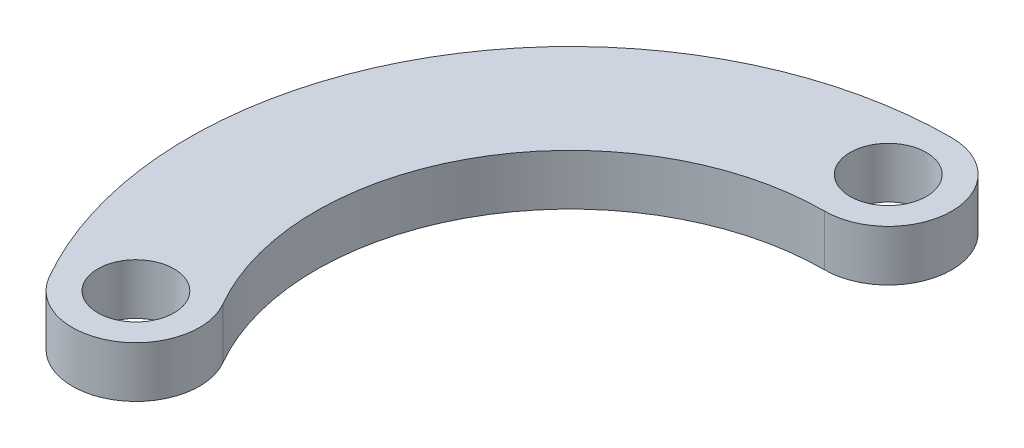
from build123d import *

# Parameters (mm, degrees)
SKETCH2_R           = 15
SKETCH2_R_2         = 10
SKETCH2_R_3         = 1.5
BOSS_EXTRUDE3_DEPTH = 2
CUT_EXTRUDE1_DEPTH  = 2
BOSS_EXTRUDE4_START = -2
SKETCH5_R           = 2.5
SKETCH5_R_2         = 1.5
BOSS_EXTRUDE4_DEPTH = 2


with BuildPart() as part:
    # Sketch2 → Boss-Extrude3 (new body)
    with BuildSketch(Plane(origin=(0, 0, 0), x_dir=(1, 0, 0), z_dir=(0, 1, 0))):
        with Locations(Location((0, 0, 0), (0, 0, 270))):
            Circle(SKETCH2_R)
        with Locations(Location((0, 0, 0), (0, 0, 270))):
            Circle(SKETCH2_R_2, mode=Mode.SUBTRACT)
        with Locations(Location((0, 12.5, 0), (0, 0, 270))):
            Circle(SKETCH2_R_3, mode=Mode.SUBTRACT)
        with Locations(Location((10.825317547, -6.25, 0), (0, 0, 270))):
            Circle(SKETCH2_R_3, mode=Mode.SUBTRACT)
        with Locations(Location((-10.825317547, -6.25, 0), (0, 0, 270))):
            Circle(SKETCH2_R_3, mode=Mode.SUBTRACT)
    extrude(amount=BOSS_EXTRUDE3_DEPTH)

    # Sketch4 → Cut-Extrude1 (cut)
    with BuildSketch(Plane(origin=(0, 2, 0), x_dir=(1, 0, 0), z_dir=(0, 1, 0))):
        Polygon((0, -17.282816366), (0, 0), (-10.825317547, -6.25), (-3.247954002, -19.374378648), (-1.635577826, -22.167096106), (6.824242843, -17.282816366), align=None)
        Polygon((9.189739722, -15.917096106), (0, 0), (0, -17.282816366), (6.824242843, -17.282816366), align=None)
        Polygon((0, 15), (0, 0), (9.189739722, -15.917096106), (6.824242843, -17.282816366), (15, -17.282816366), (15, 15), align=None)
        Polygon((-3.247954002, -19.374378648), (-10.825317547, -6.25), (-12.990381057, -7.5), (-5.413017511, -20.624378648), align=None)
    extrude(amount=-CUT_EXTRUDE1_DEPTH, mode=Mode.SUBTRACT)

    # Sketch5 → Boss-Extrude4 (add)
    # profile 1 of 2: a face of its own
    with BuildSketch(Plane(origin=(0, 2, 0), x_dir=(1, 0, 0), z_dir=(0, 1, 0)).offset(BOSS_EXTRUDE4_START)):
        with Locations((0, 12.5)):
            Circle(SKETCH5_R)
        with Locations(Location((0, 12.5, 0), (0, 0, 270))):
            Circle(SKETCH5_R_2, mode=Mode.SUBTRACT)
    # profile 2 of 2: a face of its own
    with BuildSketch(Plane(origin=(0, 2, 0), x_dir=(1, 0, 0), z_dir=(0, 1, 0)).offset(BOSS_EXTRUDE4_START)):
        with Locations((-10.825317547, -6.25)):
            Circle(SKETCH5_R)
        with Locations(Location((-10.825317547, -6.25, 0), (0, 0, 270))):
            Circle(SKETCH5_R_2, mode=Mode.SUBTRACT)
    extrude(amount=BOSS_EXTRUDE4_DEPTH)


solid = part.part
